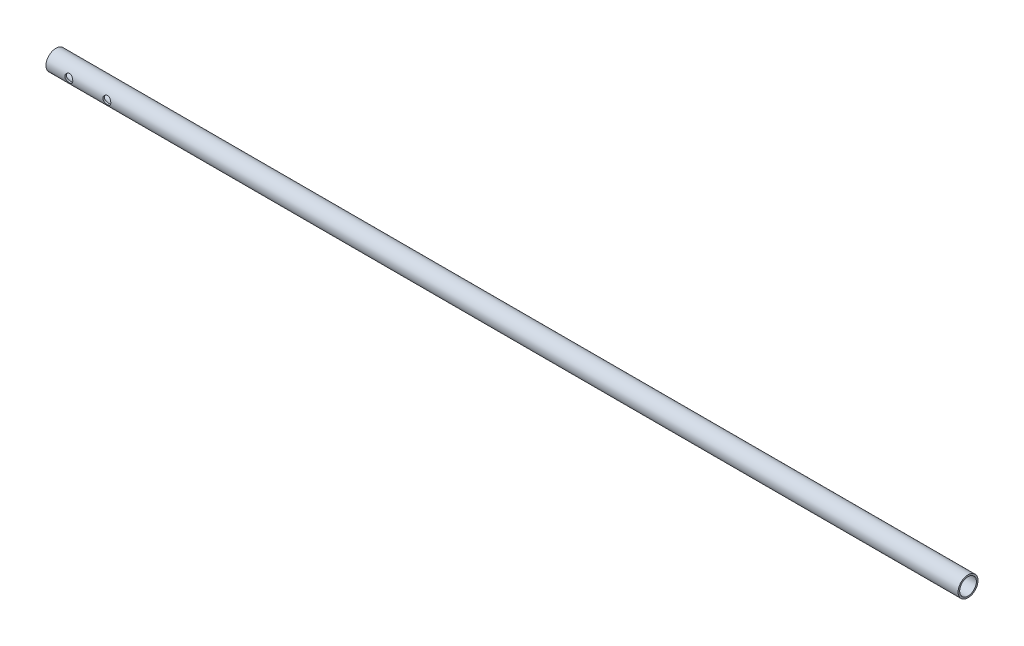
from build123d import *

# Parameters (mm, degrees)
SKETCH1_R               = 6.55
SKETCH1_R_2             = 5.5
BOSS_EXTRUDE1_DEPTH     = 600
CUT_EXTRUDE1_DEPTH      = 601.071499906
CUT_EXTRUDE1_DEPTH_BACK = 601.071499906
SKETCH3_R               = 2.625


with BuildPart() as part:
    # Sketch1 → Boss-Extrude1 (new body)
    with BuildSketch(Plane(origin=(0, 0, 0), x_dir=(0, 0, -1), z_dir=(1, 0, 0))):
        Circle(SKETCH1_R)
        Circle(SKETCH1_R_2, mode=Mode.SUBTRACT)
    extrude(amount=BOSS_EXTRUDE1_DEPTH)

    # Sketch3 → Cut-Extrude1 (cut, two sides: drawn at the far end of the back side and taken through both)
    with BuildSketch(Plane.XY.offset(-CUT_EXTRUDE1_DEPTH_BACK)):
        with Locations((15, 0)):
            Circle(SKETCH3_R)
        with Locations((40, 0)):
            Circle(SKETCH3_R)
    extrude(amount=CUT_EXTRUDE1_DEPTH + CUT_EXTRUDE1_DEPTH_BACK, mode=Mode.SUBTRACT)


solid = part.part
